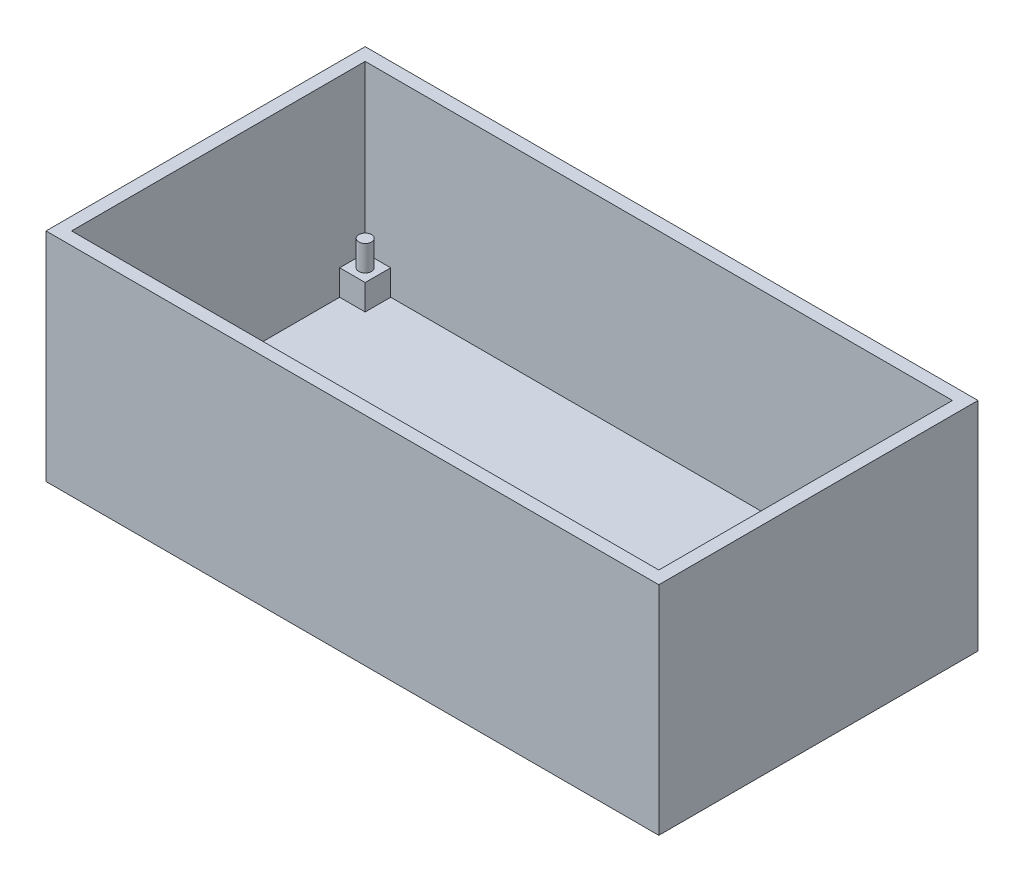
from build123d import *

# Parameters (mm, degrees)
SKETCH1_W           = 121.92
SKETCH1_H           = 63.5
BOSS_EXTRUDE1_DEPTH = 5.08
SKETCH2_W           = 121.92
SKETCH2_H           = 63.5
SKETCH2_W_2         = 116.84
SKETCH2_H_2         = 58.42
BOSS_EXTRUDE2_DEPTH = 38.1
SKETCH4_W           = 5.08
SKETCH4_H           = 5.08
BOSS_EXTRUDE3_DEPTH = 5.08
SKETCH5_R           = 1.27
BOSS_EXTRUDE4_DEPTH = 5.08


with BuildPart() as part:
    # Sketch1 → Boss-Extrude1 (new body)
    with BuildSketch(Plane(origin=(0, 0, 0), x_dir=(1, 0, 0), z_dir=(0, 1, 0))):
        with Locations((60.96, 31.75)):
            Rectangle(SKETCH1_W, SKETCH1_H)
    extrude(amount=BOSS_EXTRUDE1_DEPTH)

    # Sketch2 → Boss-Extrude2 (add)
    with BuildSketch(Plane(origin=(0, 5.08, 0), x_dir=(1, 0, 0), z_dir=(0, 1, 0))):
        with Locations((60.96, 31.75)):
            Rectangle(SKETCH2_W, SKETCH2_H)
        with Locations((60.96, 31.75)):
            Rectangle(SKETCH2_W_2, SKETCH2_H_2, mode=Mode.SUBTRACT)
    extrude(amount=BOSS_EXTRUDE2_DEPTH)

    # Sketch4 → Boss-Extrude3 (add)
    with BuildSketch(Plane(origin=(0, 5.08, 0), x_dir=(1, 0, 0), z_dir=(0, 1, 0))):
        with Locations((5.08, 58.42)):
            Rectangle(SKETCH4_W, SKETCH4_H)
        with Locations((116.84, 58.42)):
            Rectangle(SKETCH4_W, SKETCH4_H)
        with Locations((116.84, 5.08)):
            Rectangle(SKETCH4_W, SKETCH4_H)
        with Locations((5.08, 5.08)):
            Rectangle(SKETCH4_W, SKETCH4_H)
    extrude(amount=BOSS_EXTRUDE3_DEPTH)

    # Sketch5 → Boss-Extrude4 (add)
    with BuildSketch(Plane(origin=(0, 10.16, 0), x_dir=(1, 0, 0), z_dir=(0, 1, 0))):
        with Locations(Location((5.08, 58.42, 0), (0, 0, 270))):
            Circle(SKETCH5_R)
        with Locations(Location((116.84, 58.42, 0), (0, 0, 270))):
            Circle(SKETCH5_R)
        with Locations(Location((116.84, 5.08, 0), (0, 0, 270))):
            Circle(SKETCH5_R)
        with Locations(Location((5.08, 5.08, 0), (0, 0, 270))):
            Circle(SKETCH5_R)
    extrude(amount=BOSS_EXTRUDE4_DEPTH)


solid = part.part
